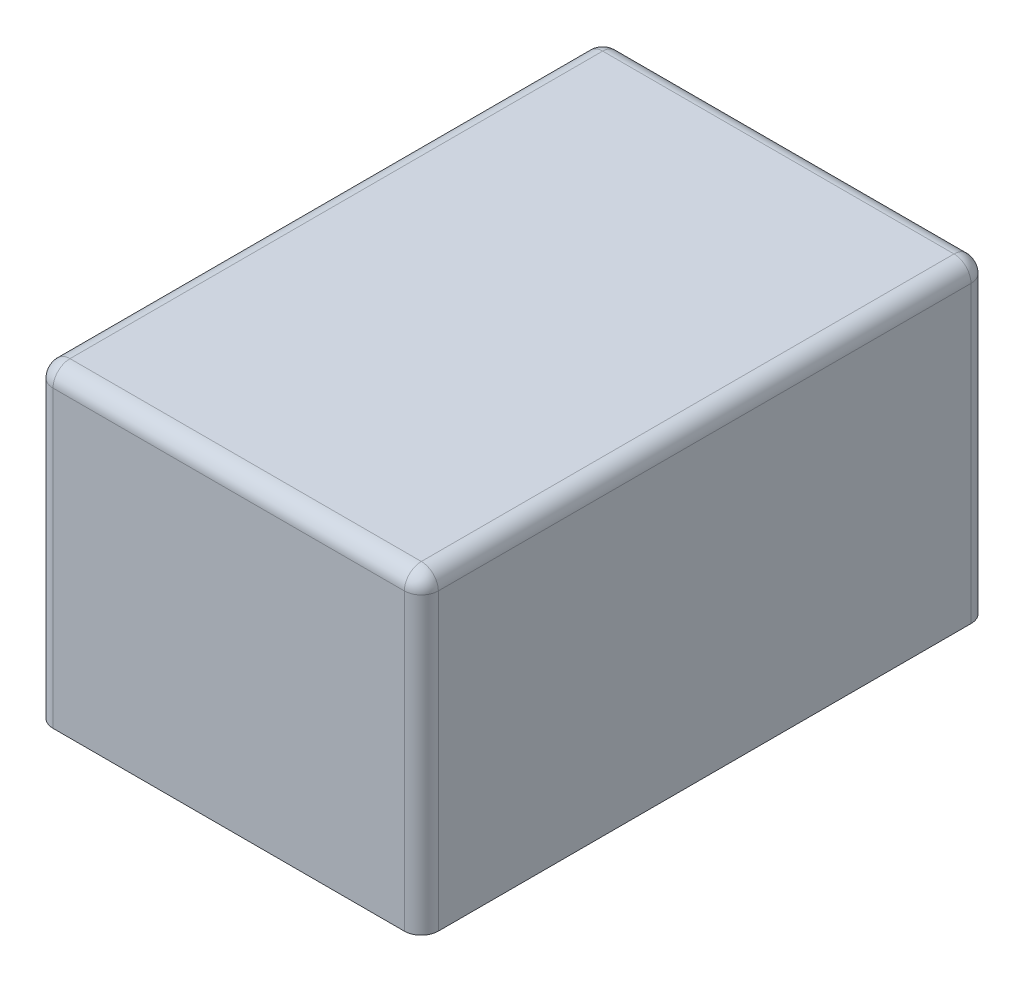
from build123d import *

# Parameters (mm, degrees)
SKETCH1_W           = 68
SKETCH1_H           = 55
BOSS_EXTRUDE1_DEPTH = 100
FILLET1_R           = 3


with BuildPart() as part:
    # Sketch1 → Boss-Extrude1 (new body)
    with BuildSketch(Plane.XY):
        with Locations((34, 27.5)):
            Rectangle(SKETCH1_W, SKETCH1_H)
    extrude(amount=BOSS_EXTRUDE1_DEPTH)

    # Fillet1
    fillet1_edges = [part.edges().sort_by_distance(p)[0] for p in [
        (68, 55, 50),
        (34, 55, 0),
        (0, 55, 50),
        (0, 27.5, 100),
        (0, 27.5, 0),
        (68, 27.5, 0),
        (68, 27.5, 100),
        (34, 55, 100),
    ]]
    fillet(fillet1_edges, radius=FILLET1_R)


solid = part.part
